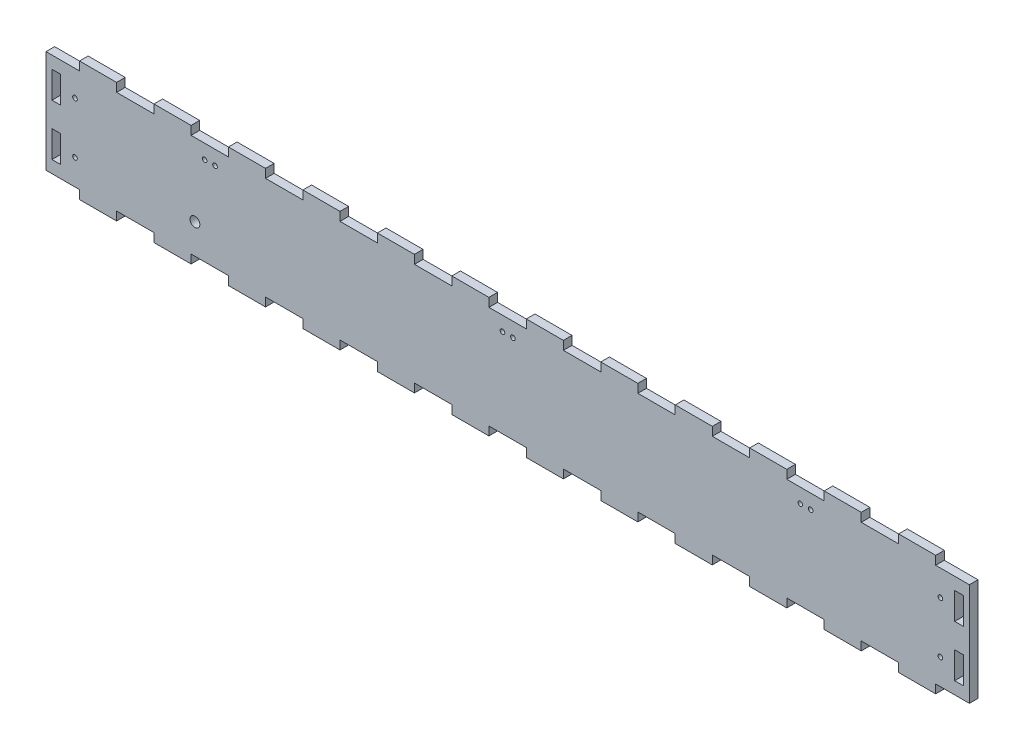
from build123d import *

# Parameters (mm, degrees)
SKETCH1_R           = 3.3
SKETCH1_R_2         = 1.55
SKETCH1_W           = 5.85
SKETCH1_H           = 18
BOSS_EXTRUDE1_DEPTH = 5.8


with BuildPart() as part:
    # Sketch1 → Boss-Extrude1 (new body)
    with BuildSketch(Plane.XY):
        Polygon((-237.5, 34.5), (-237.5, 40.3), (-212.6, 40.3), (-212.6, 34.5), (-187.5, 34.5), (-187.5, 40.3), (-162.6, 40.3), (-162.6, 34.5), (-137.5, 34.5), (-137.5, 40.3), (-112.6, 40.3), (-112.6, 34.5), (-87.5, 34.5), (-87.5, 40.3), (-62.6, 40.3), (-62.6, 34.5), (-37.5, 34.5), (-37.5, 40.3), (-12.6, 40.3), (-12.6, 34.5), (12.5, 34.5), (12.5, 40.3), (37.4, 40.3), (37.4, 34.5), (62.5, 34.5), (62.5, 40.3), (87.4, 40.3), (87.4, 34.5), (112.5, 34.5), (112.5, 40.3), (137.4, 40.3), (137.4, 34.5), (162.5, 34.5), (162.5, 40.3), (187.4, 40.3), (187.4, 34.5), (212.5, 34.5), (212.5, 40.3), (237.4, 40.3), (237.4, 34.5), (262.5, 34.5), (262.5, 40.3), (287.4, 40.3), (287.4, 34.5), (310, 34.5), (310, -34.5), (287.4, -34.5), (287.4, -40.3), (262.5, -40.3), (262.5, -34.5), (237.4, -34.5), (237.4, -40.3), (212.5, -40.3), (212.5, -34.5), (187.4, -34.5), (187.4, -40.3), (162.5, -40.3), (162.5, -34.5), (137.4, -34.5), (137.4, -40.3), (112.5, -40.3), (112.5, -34.5), (87.4, -34.5), (87.4, -40.3), (62.5, -40.3), (62.5, -34.5), (37.4, -34.5), (37.4, -40.3), (12.5, -40.3), (12.5, -34.5), (-12.6, -34.5), (-12.6, -40.3), (-37.5, -40.3), (-37.5, -34.5), (-62.6, -34.5), (-62.6, -40.3), (-87.5, -40.3), (-87.5, -34.5), (-112.6, -34.5), (-112.6, -40.3), (-137.5, -40.3), (-137.5, -34.5), (-162.6, -34.5), (-162.6, -40.3), (-187.5, -40.3), (-187.5, -34.5), (-212.6, -34.5), (-212.6, -40.3), (-237.5, -40.3), (-237.5, -34.5), (-262.6, -34.5), (-262.6, -40.3), (-287.5, -40.3), (-287.5, -34.5), (-310, -34.5), (-310, 34.5), (-287.5, 34.5), (-287.5, 40.3), (-262.6, 40.3), (-262.6, 34.5), align=None)
        with Locations((-210, -14.5)):
            Circle(SKETCH1_R, mode=Mode.SUBTRACT)
        with Locations((-290.53, 17.25)):
            Circle(SKETCH1_R_2, mode=Mode.SUBTRACT)
        with Locations(Location((-290.53, -17.25, 0), (0, 0, 180))):
            Circle(SKETCH1_R_2, mode=Mode.SUBTRACT)
        with Locations((290.53, -17.25)):
            Circle(SKETCH1_R_2, mode=Mode.SUBTRACT)
        with Locations(Location((290.53, 17.25, 0), (0, 0, 180))):
            Circle(SKETCH1_R_2, mode=Mode.SUBTRACT)
        with Locations((3.5, 24.88)):
            Circle(SKETCH1_R_2, mode=Mode.SUBTRACT)
        with Locations(Location((-3.5, 24.88, 0), (0, 0, 180))):
            Circle(SKETCH1_R_2, mode=Mode.SUBTRACT)
        with Locations(Location((196.5, 24.88, 0), (0, 0, 180))):
            Circle(SKETCH1_R_2, mode=Mode.SUBTRACT)
        with Locations((203.5, 24.88)):
            Circle(SKETCH1_R_2, mode=Mode.SUBTRACT)
        with Locations((-196.5, 24.88)):
            Circle(SKETCH1_R_2, mode=Mode.SUBTRACT)
        with Locations(Location((-203.5, 24.88, 0), (0, 0, 180))):
            Circle(SKETCH1_R_2, mode=Mode.SUBTRACT)
        with Locations((303.075, 17.25)):
            Rectangle(SKETCH1_W, SKETCH1_H, mode=Mode.SUBTRACT)
        with Locations((303.075, -17.25)):
            Rectangle(SKETCH1_W, SKETCH1_H, mode=Mode.SUBTRACT)
        with Locations((-303.075, -17.25)):
            Rectangle(SKETCH1_W, SKETCH1_H, mode=Mode.SUBTRACT)
        with Locations((-303.075, 17.25)):
            Rectangle(SKETCH1_W, SKETCH1_H, mode=Mode.SUBTRACT)
    extrude(amount=BOSS_EXTRUDE1_DEPTH)


solid = part.part
